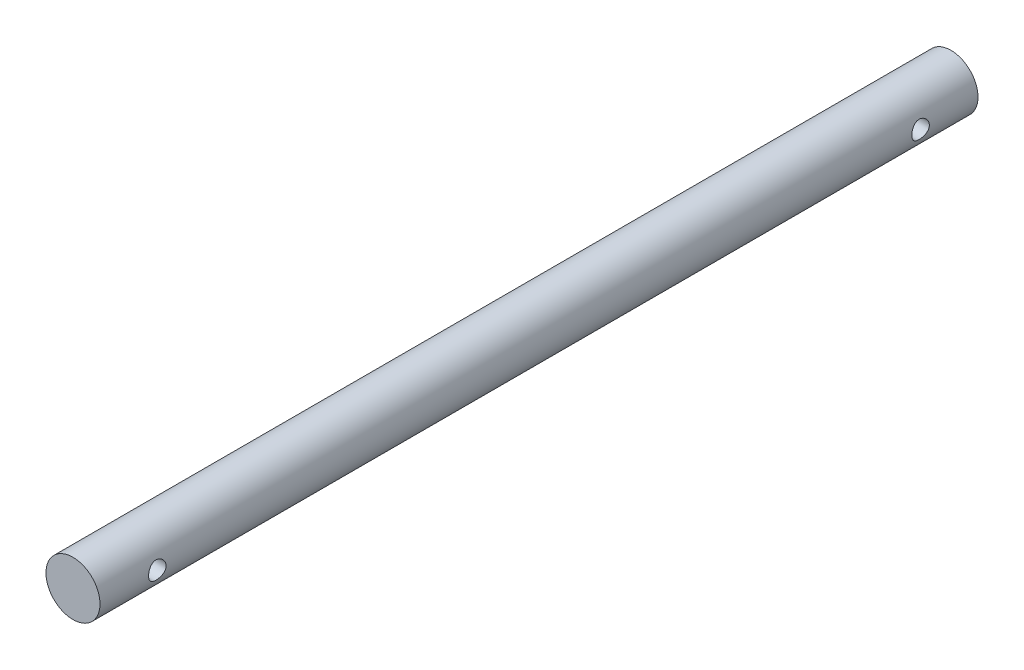
from build123d import *

# Parameters (mm, degrees)
SKETCH1_R           = 4
BOSS_EXTRUDE1_DEPTH = 65
SKETCH2_R           = 1.3
CUT_EXTRUDE1_DEPTH  = 66.245689513


with BuildPart() as part:
    # Sketch1 → Boss-Extrude1 (new, symmetric)
    with BuildSketch(Plane.XY):
        Circle(SKETCH1_R)
    extrude(amount=BOSS_EXTRUDE1_DEPTH, both=True)

    # Sketch2 → Cut-Extrude1 (cut, symmetric)
    with BuildSketch(Plane(origin=(0, 0, 0), x_dir=(0, 0, -1), z_dir=(1, 0, 0))):
        with Locations((56.5, 0)):
            Circle(SKETCH2_R)
    cut_extrude1 = extrude(amount=CUT_EXTRUDE1_DEPTH, both=True, mode=Mode.SUBTRACT)

    # Mirror1: Cut-Extrude1 across plane
    add(cut_extrude1.mirror(Plane.XY), mode=Mode.SUBTRACT)


solid = part.part
